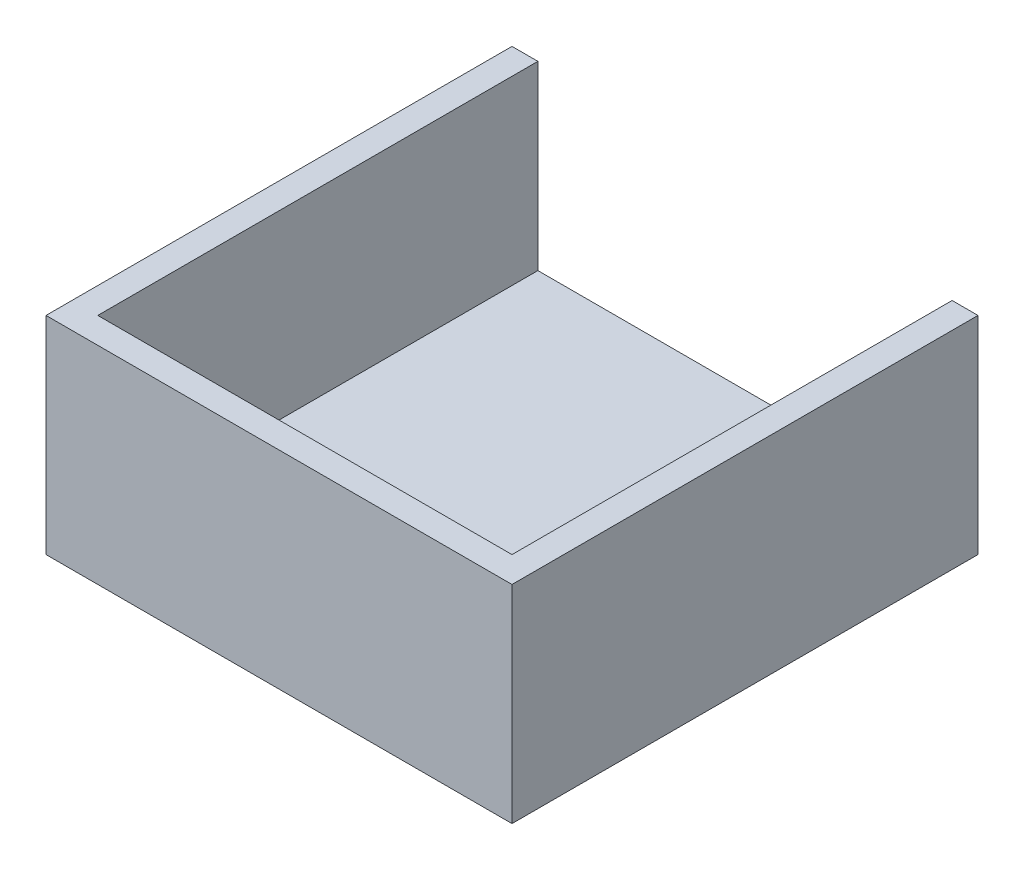
from build123d import *

# Parameters (mm, degrees)
SKETCH_1_W          = 18
SKETCH_1_H          = 18
EXTRUDE_1_DEPTH     = 8
CUT_EXTRUDE_START   = 8
SKETCH_5_W          = 16
SKETCH_5_H          = 17
CUT_EXTRUDE_6_DEPTH = 7
EXTRUDE_START       = 8
SKETCH_6_W          = 18
SKETCH_6_H          = 18
EXTRUDE_2_DEPTH     = 1
CUT_EXTRUDE_START_2 = 9
SKETCH_7_R          = 6.5
CUT_EXTRUDE_7_DEPTH = 1
SKETCH_10_W         = 18
SKETCH_10_H         = 18
CUT_EXTRUDE_8_DEPTH = 1


with BuildPart() as part:
    # 스케치1 → 보스-돌출1 (new body)
    with BuildSketch(Plane(origin=(0, 0, 0), x_dir=(1, 0, 0), z_dir=(0, 1, 0))):
        Rectangle(SKETCH_1_W, SKETCH_1_H)
    extrude(amount=EXTRUDE_1_DEPTH)

    # 스케치5 → 컷-돌출6 (cut)
    with BuildSketch(Plane(origin=(0, 0, 0), x_dir=(1, 0, 0), z_dir=(0, 1, 0)).offset(CUT_EXTRUDE_START)):
        with Locations((0, 0.5)):
            Rectangle(SKETCH_5_W, SKETCH_5_H)
    extrude(amount=-CUT_EXTRUDE_6_DEPTH, mode=Mode.SUBTRACT)


with BuildPart() as body_2:
    # 스케치6 → 보스-돌출2 (new body)
    with BuildSketch(Plane(origin=(0, 0, 0), x_dir=(1, 0, 0), z_dir=(0, 1, 0)).offset(EXTRUDE_START)):
        Rectangle(SKETCH_6_W, SKETCH_6_H)
    extrude(amount=EXTRUDE_2_DEPTH)

    # 스케치7 → 컷-돌출7 (cut)
    with BuildSketch(Plane(origin=(0, 0, 0), x_dir=(1, 0, 0), z_dir=(0, 1, 0)).offset(CUT_EXTRUDE_START_2)):
        with Locations(Location((0, -0.5, 0), (0, 0, 270))):
            Circle(SKETCH_7_R)
    extrude(amount=-CUT_EXTRUDE_7_DEPTH, mode=Mode.SUBTRACT)

    # 스케치10 → 컷-돌출8 (cut)
    with BuildSketch(Plane(origin=(0, 9, 0), x_dir=(1, 0, 0), z_dir=(0, 1, 0))):
        Rectangle(SKETCH_10_W, SKETCH_10_H)
    extrude(amount=-CUT_EXTRUDE_8_DEPTH, mode=Mode.SUBTRACT)


solid = part.part
